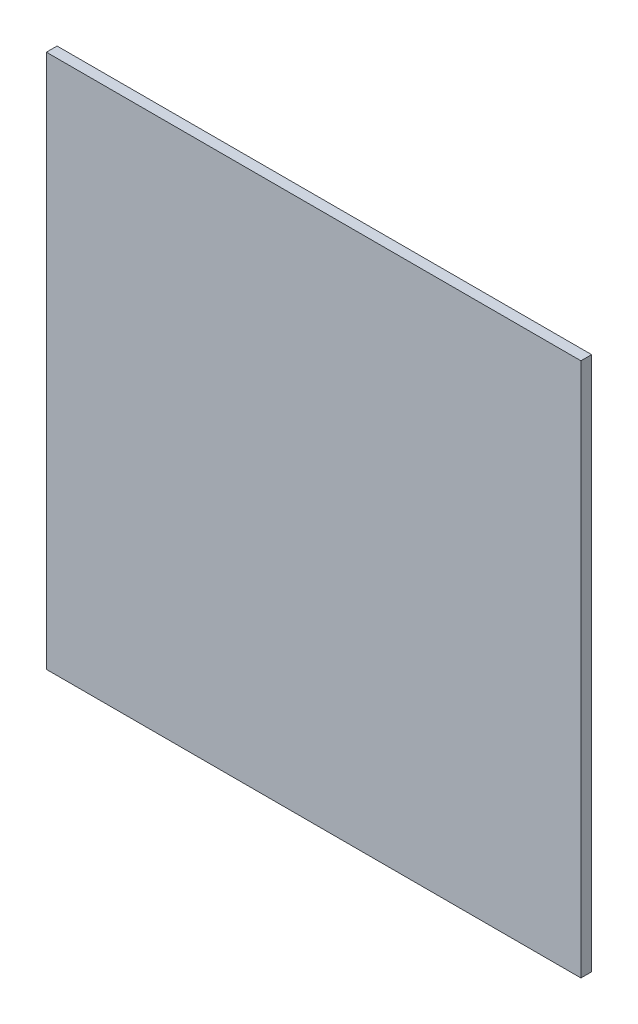
from build123d import *

# Parameters (mm, degrees)
SKETCH1_W           = 250
SKETCH1_H           = 250
BOSS_EXTRUDE1_DEPTH = 5


with BuildPart() as part:
    # Sketch1 → Boss-Extrude1 (new body)
    with BuildSketch(Plane.XY):
        Rectangle(SKETCH1_W, SKETCH1_H)
    extrude(amount=BOSS_EXTRUDE1_DEPTH)


solid = part.part
